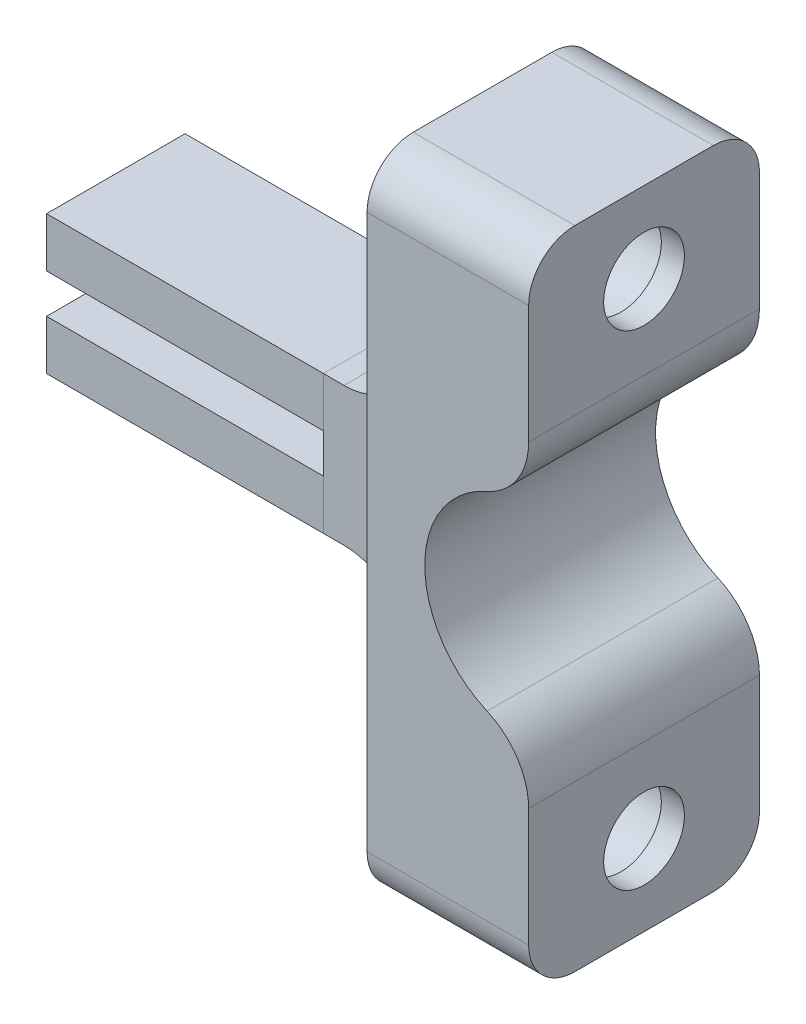
from build123d import *

# Parameters (mm, degrees)
SKETCH1_W               = 12
SKETCH1_H               = 2.15
BOSS_EXTRUDE1_DEPTH     = 3
BOSS_EXTRUDE1_2_DEPTH   = 3
SKETCH2_W               = 4
SKETCH2_H               = 6
BOSS_EXTRUDE2_DEPTH     = 6
SKETCH3_W               = 7
SKETCH3_H               = 28
BOSS_EXTRUDE3_DEPTH     = 5
CUT_EXTRUDE1_DEPTH      = 25.108425983
CUT_EXTRUDE1_DEPTH_BACK = 25.108425983
SKETCH5_R               = 4.5
FILLET1_R               = 3
FILLET2_R               = 2
SKETCH6_R               = 2.25
CUT_EXTRUDE2_DEPTH      = 16
SKETCH7_R               = 3.026985479
SKETCH7_R_2             = 1.75
SKETCH7_R_3             = 2.865005671
BOSS_EXTRUDE4_DEPTH     = 1


with BuildPart() as part:
    # Sketch1 → Boss-Extrude1 (new, symmetric)
    with BuildSketch(Plane.XY):
        with Locations((0, 1.925)):
            Rectangle(SKETCH1_W, SKETCH1_H)
    extrude(amount=BOSS_EXTRUDE1_DEPTH, both=True)


with BuildPart() as body_2:
    # Sketch1 → Boss-Extrude1 2 (new, symmetric)
    with BuildSketch(Plane.XY):
        with Locations((0, -1.925)):
            Rectangle(SKETCH1_W, SKETCH1_H)
    extrude(amount=BOSS_EXTRUDE1_2_DEPTH, both=True)


with BuildPart() as body_3:
    # Sketch2 → Boss-Extrude2 (new body)
    with BuildSketch(Plane.XY.offset(3)):
        with Locations((8, 0)):
            Rectangle(SKETCH2_W, SKETCH2_H)
    extrude(amount=-BOSS_EXTRUDE2_DEPTH)

    # Sketch3 → Boss-Extrude3 (add, symmetric)
    with BuildSketch(Plane.XY):
        with Locations((13.388345193, 0)):
            Rectangle(SKETCH3_W, SKETCH3_H)
    extrude(amount=BOSS_EXTRUDE3_DEPTH, both=True)

    # Sketch5 → Cut-Extrude1 (cut, two sides: drawn at the far end of the back side and taken through both)
    with BuildSketch(Plane.XY.offset(5).offset(-CUT_EXTRUDE1_DEPTH_BACK)):
        with Locations((16.888345193, 0)):
            Circle(SKETCH5_R)
    extrude(amount=CUT_EXTRUDE1_DEPTH + CUT_EXTRUDE1_DEPTH_BACK, mode=Mode.SUBTRACT)

    # Fillet1
    fillet1_edges = [body_3.edges().sort_by_distance(p)[0] for p in [
        (9.888345193, -3, 0),
        (9.888345193, 3, 0),
        (16.888345193, -4.5, 0),
        (16.888345193, 4.5, 0),
    ]]
    fillet(fillet1_edges, radius=FILLET1_R)

    # Fillet2
    fillet2_edges = [body_3.edges().sort_by_distance(p)[0] for p in [
        (13.388345193, -14, -5),
        (13.388345193, 14, -5),
        (13.388345193, -14, 5),
        (13.388345193, 14, 5),
    ]]
    fillet(fillet2_edges, radius=FILLET2_R)

    # Sketch6 → Cut-Extrude2 (cut)
    with BuildSketch(Plane(origin=(16.888345193, 0, 0), x_dir=(0, 0, -1), z_dir=(1, 0, 0))):
        with Locations((0, 10.5)):
            Circle(SKETCH6_R)
        with Locations((0, -10.5)):
            Circle(SKETCH6_R)
    extrude(amount=-CUT_EXTRUDE2_DEPTH, mode=Mode.SUBTRACT)

    # Sketch7 → Boss-Extrude4 (add)
    # profile 1 of 2: a face of its own
    with BuildSketch(Plane(origin=(16.888345193, 0, 0), x_dir=(0, 0, -1), z_dir=(1, 0, 0))):
        with Locations((0, 10.5)):
            Circle(SKETCH7_R)
        with Locations((0, 10.5)):
            Circle(SKETCH7_R_2, mode=Mode.SUBTRACT)
    # profile 2 of 2: a face of its own
    with BuildSketch(Plane(origin=(16.888345193, 0, 0), x_dir=(0, 0, -1), z_dir=(1, 0, 0))):
        with Locations((0, -10.5)):
            Circle(SKETCH7_R_3)
        with Locations((0, -10.5)):
            Circle(SKETCH7_R_2, mode=Mode.SUBTRACT)
    extrude(amount=-BOSS_EXTRUDE4_DEPTH)


solid = Compound([part.part, body_2.part, body_3.part])
